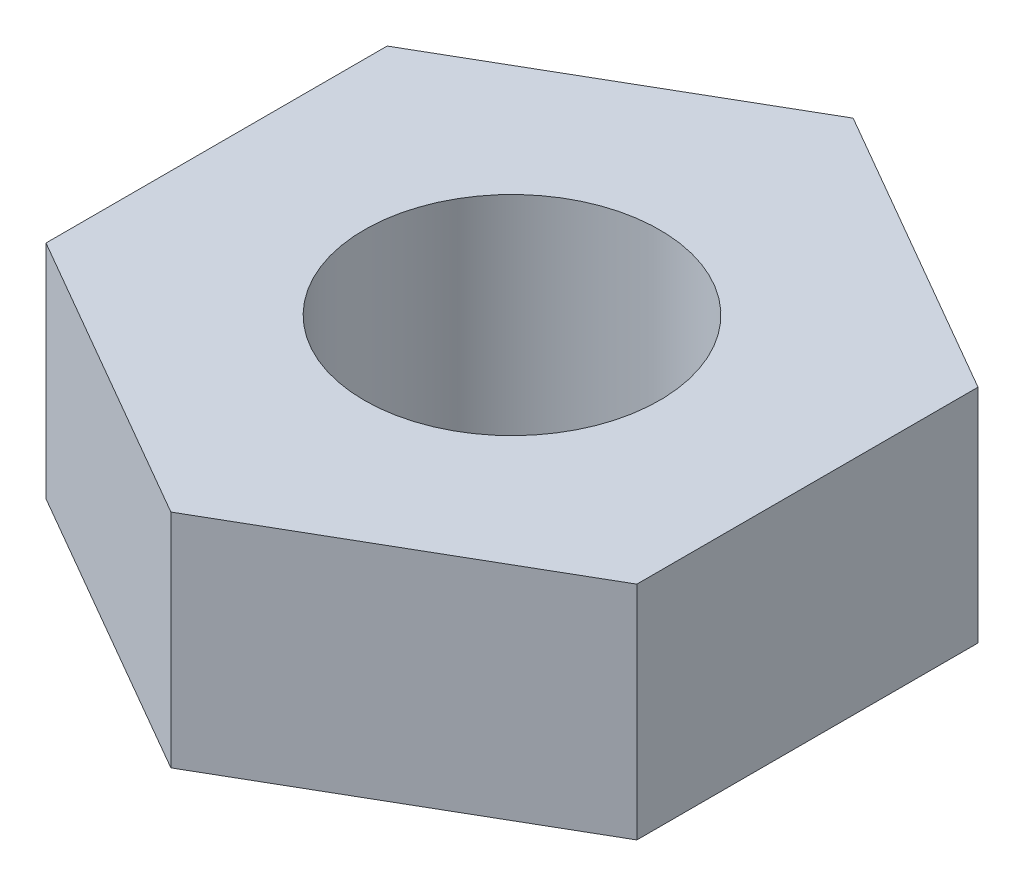
from build123d import *

# Parameters (mm, degrees)
SKETCH1_R           = 1
BOSS_EXTRUDE1_DEPTH = 1.5


with BuildPart() as part:
    # Sketch1 → Boss-Extrude1 (new body)
    with BuildSketch(Plane(origin=(0, 0, 0), x_dir=(1, 0, 0), z_dir=(0, 1, 0))):
        Polygon((0, 2.309401077), (-2, 1.154700538), (-2, -1.154700538), (0, -2.309401077), (2, -1.154700538), (2, 1.154700538), align=None)
        with Locations(Location((0, 0, 0), (0, 0, 270))):
            Circle(SKETCH1_R, mode=Mode.SUBTRACT)
    extrude(amount=BOSS_EXTRUDE1_DEPTH)


solid = part.part
